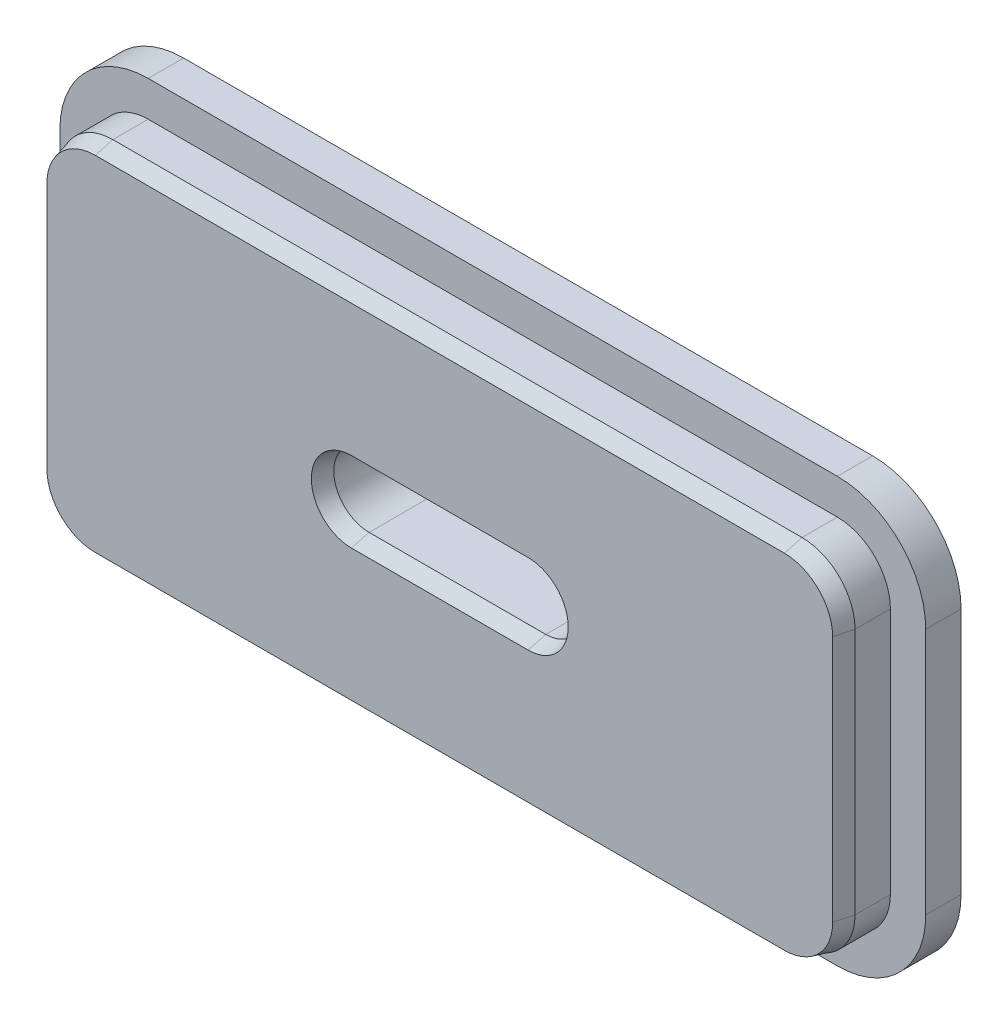
from build123d import *

# Parameters (mm, degrees)
BOSS_EXTRU_1_DEPTH = 2
BOSS_EXTRU_2_DEPTH = 0.5
BOSS_EXTRU_2_DRAFT = 15
BOSS_EXTRU_3_DEPTH = 1


with BuildPart() as part:
    # Esquisse1 → Boss.-Extru.1 (new body)
    with BuildSketch(Plane.XY):
        with BuildLine():
            Line((-9.75, 5), (9.75, 5))
            ThreePointArc((9.75, 5), (10.810660172, 4.560660172), (11.25, 3.5))
            Line((11.25, 3.5), (11.25, -3.5))
            ThreePointArc((11.25, -3.5), (10.810660172, -4.560660172), (9.75, -5))
            Line((9.75, -5), (-9.75, -5))
            ThreePointArc((-9.75, -5), (-10.810660172, -4.560660172), (-11.25, -3.5))
            Line((-11.25, -3.5), (-11.25, 3.5))
            ThreePointArc((-11.25, 3.5), (-10.810660172, 4.560660172), (-9.75, 5))
        make_face()
        with BuildLine():
            Line((-2.5, 1), (2.5, 1))
            ThreePointArc((2.5, 1), (3.5, 0), (2.5, -1))
            Line((2.5, -1), (-2.5, -1))
            ThreePointArc((-2.5, -1), (-3.5, 0), (-2.5, 1))
        make_face(mode=Mode.SUBTRACT)
    extrude(amount=BOSS_EXTRU_1_DEPTH)


with BuildPart() as boss_extru_2_tool:
    # Esquisse2 → Boss.-Extru.2 (with draft: the straight prism first)
    with BuildSketch(Plane.XY.offset(2)):
        with BuildLine():
            Line((-9.75, -5), (9.75, -5))
            ThreePointArc((9.75, -5), (10.810660172, -4.560660172), (11.25, -3.5))
            Line((11.25, -3.5), (11.25, 3.5))
            ThreePointArc((11.25, 3.5), (10.810660172, 4.560660172), (9.75, 5))
            Line((9.75, 5), (-9.75, 5))
            ThreePointArc((-9.75, 5), (-10.810660172, 4.560660172), (-11.25, 3.5))
            Line((-11.25, 3.5), (-11.25, -3.5))
            ThreePointArc((-11.25, -3.5), (-10.810660172, -4.560660172), (-9.75, -5))
        make_face()
        with BuildLine():
            Line((2.5, 1), (-2.5, 1))
            ThreePointArc((-2.5, 1), (-3.5, 0), (-2.5, -1))
            Line((-2.5, -1), (2.5, -1))
            ThreePointArc((2.5, -1), (3.5, 0), (2.5, 1))
        make_face(mode=Mode.SUBTRACT)
    extrude(amount=BOSS_EXTRU_2_DEPTH)
    # Boss.-Extru.2: the draft: its side faces are tilted about the plane it starts from
    boss_extru_2_sides = [boss_extru_2_tool.faces().sort_by_distance(p)[0] for p in [
        (0, -5, 2.25),
        (10.810660172, -4.560660172, 2.25),
        (11.25, 0, 2.25),
        (10.810660172, 4.560660172, 2.25),
        (0, 5, 2.25),
        (-10.810660172, 4.560660172, 2.25),
        (-11.25, 0, 2.25),
        (-10.810660172, -4.560660172, 2.25),
        (-3.5, 0, 2.25),
        (0, 1, 2.25),
        (3.5, 0, 2.25),
        (0, -1, 2.25),
    ]]
    draft(boss_extru_2_sides, Plane.XY.offset(2), BOSS_EXTRU_2_DRAFT)


with BuildPart() as part_1:
    add(part.part)

    # Boss.-Extru.2: add boss_extru_2_tool
    add(boss_extru_2_tool.part)

    # Esquisse3 → Boss.-Extru.3 (add)
    with BuildSketch(Plane(origin=(0, 0, 0), x_dir=(-1, 0, 0), z_dir=(0, 0, -1))):
        with BuildLine():
            Line((12.25, -3.5), (12.25, 3.5))
            ThreePointArc((12.25, 3.5), (11.517766953, 5.267766953), (9.75, 6))
            Line((9.75, 6), (-9.75, 6))
            ThreePointArc((-9.75, 6), (-11.517766953, 5.267766953), (-12.25, 3.5))
            Line((-12.25, 3.5), (-12.25, -3.5))
            ThreePointArc((-12.25, -3.5), (-11.517766953, -5.267766953), (-9.75, -6))
            Line((-9.75, -6), (9.75, -6))
            ThreePointArc((9.75, -6), (11.517766953, -5.267766953), (12.25, -3.5))
        make_face()
        with BuildLine():
            Line((11.25, -3.5), (11.25, 3.5))
            ThreePointArc((11.25, 3.5), (10.810660172, 4.560660172), (9.75, 5))
            Line((9.75, 5), (-9.75, 5))
            ThreePointArc((-9.75, 5), (-10.810660172, 4.560660172), (-11.25, 3.5))
            Line((-11.25, 3.5), (-11.25, -3.5))
            ThreePointArc((-11.25, -3.5), (-10.810660172, -4.560660172), (-9.75, -5))
            Line((-9.75, -5), (9.75, -5))
            ThreePointArc((9.75, -5), (10.810660172, -4.560660172), (11.25, -3.5))
        make_face(mode=Mode.SUBTRACT)
    extrude(amount=-BOSS_EXTRU_3_DEPTH)


solid = part_1.part
